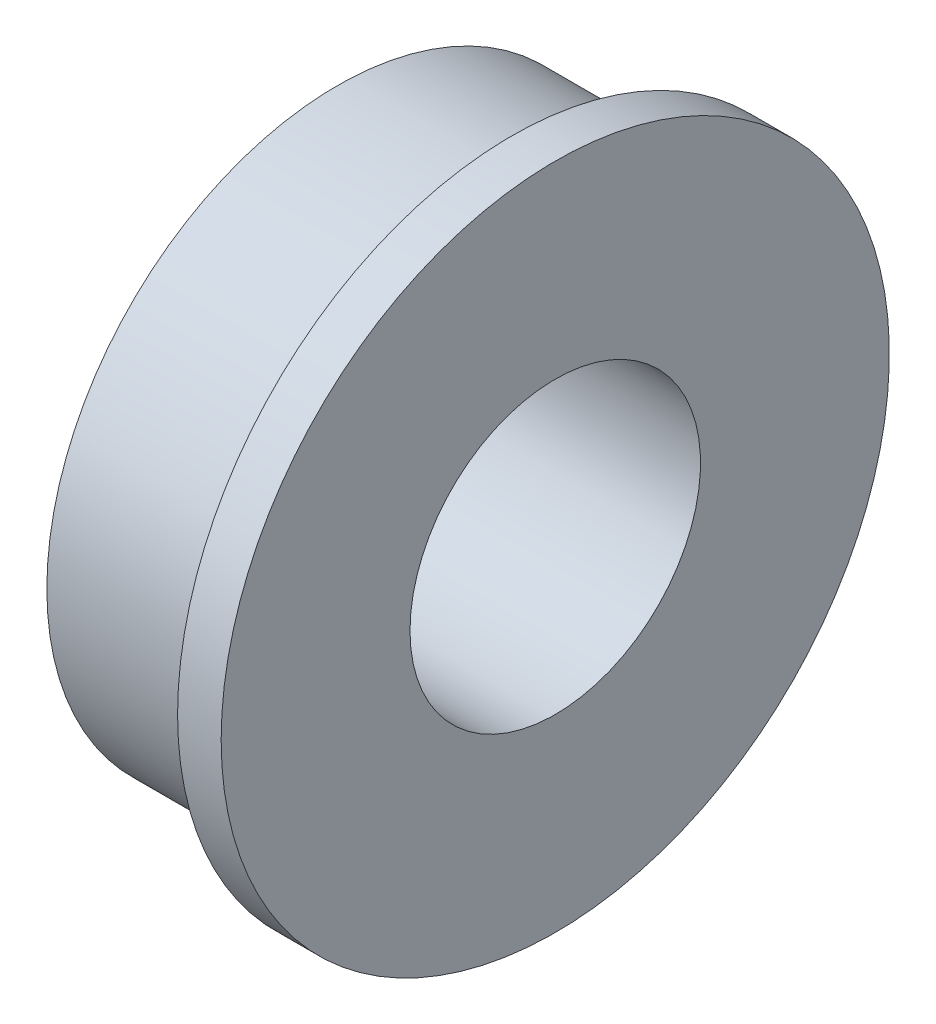
from build123d import *


with BuildPart() as part:
    # Sketch1 → Revolve1 (revolve)
    with BuildSketch(Plane.XY, mode=Mode.PRIVATE) as revolve1_sk:
        Polygon((0, 2), (3, 2), (3, 4.6), (2.4, 4.6), (2.4, 4), (0, 4), align=None)
    revolve(revolve1_sk.sketch.rotate(Axis((0, 0, 0), (1, 0, 0)), 90), axis=Axis((0, 0, 0), (1, 0, 0)))


solid = part.part
